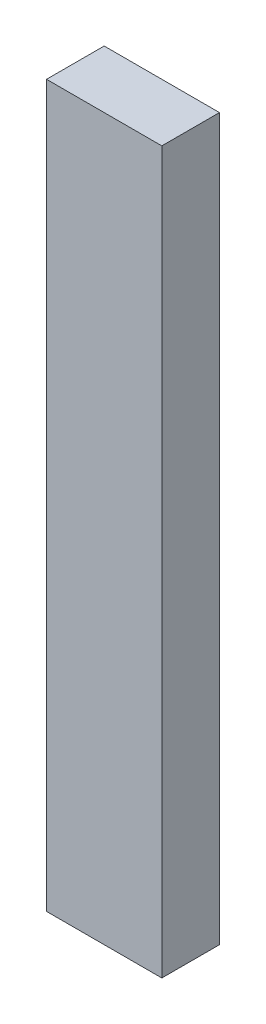
from build123d import *

# Parameters (mm, degrees)
SKETCH5_W           = 8
SKETCH5_H           = 4
BOSS_EXTRUDE4_DEPTH = 50


with BuildPart() as part:
    # Sketch5 → Boss-Extrude4 (new body)
    with BuildSketch(Plane(origin=(0, 1, 0), x_dir=(1, 0, 0), z_dir=(0, 1, 0))):
        Rectangle(SKETCH5_W, SKETCH5_H)
    extrude(amount=BOSS_EXTRUDE4_DEPTH)


solid = part.part
